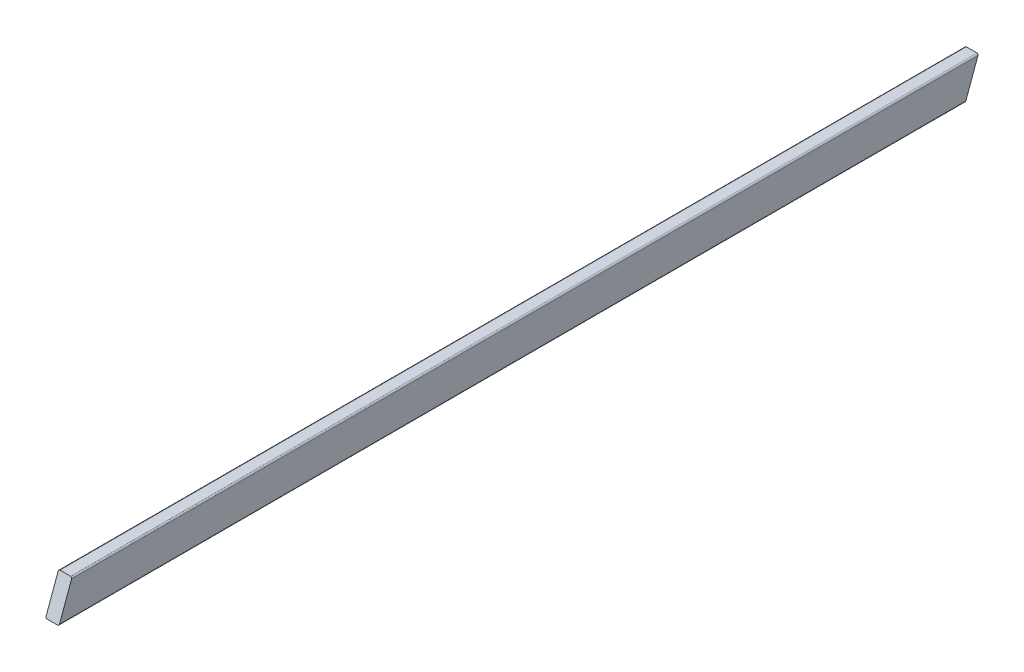
from build123d import *

# Parameters (mm, degrees)
ESBO_O1_W                = 9.525
ESBO_O1_H                = 25.4
RESSALTO_EXTRUS_O1_DEPTH = 400
ESBO_O3_OUTSIDE_W        = 962.092
ESBO_O3_OUTSIDE_H        = 187.492
CORTE_EXTRUS_O2_DEPTH    = 401.314895582
FILETE1_R                = 1


with BuildPart() as part:
    # Esboço1 → Ressalto-extrusão1 (new, symmetric)
    with BuildSketch(Plane.XY):
        Rectangle(ESBO_O1_W, ESBO_O1_H)
    extrude(amount=RESSALTO_EXTRUS_O1_DEPTH, both=True)

    # Esboço3 outside → Corte-extrusão2 (cut, through all)
    with BuildSketch(Plane(origin=(4.7625, 0, 0), x_dir=(0, 0, -1), z_dir=(1, 0, 0))):
        Rectangle(ESBO_O3_OUTSIDE_W, ESBO_O3_OUTSIDE_H)
        Polygon((-326.126489707, -12.7), (316.881645756, -12.7), (326.126489707, 12.7), (-316.881645756, 12.7), align=None, mode=Mode.SUBTRACT)
    extrude(amount=-CORTE_EXTRUS_O2_DEPTH, mode=Mode.SUBTRACT)

    # Filete1
    filete1_edges = [part.edges().sort_by_distance(p)[0] for p in [
        (4.7625, -12.7, 4.622421975),
        (-4.7625, -12.7, 4.622421975),
        (-4.7625, 12.7, -4.622421975),
        (4.7625, 12.7, -4.622421975),
    ]]
    fillet(filete1_edges, radius=FILETE1_R)


solid = part.part
